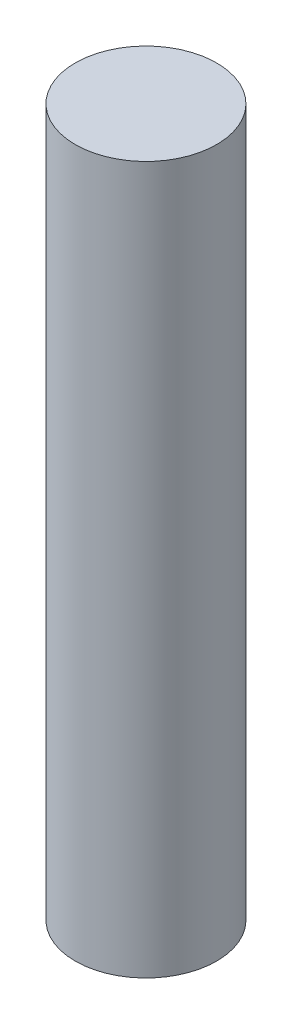
from build123d import *

# Parameters (mm, degrees)
SKETCH_1_R      = 1.5
EXTRUDE_1_DEPTH = 15


with BuildPart() as part:
    # 草图1 → 拉伸1 (new body)
    with BuildSketch(Plane(origin=(0, 0, 0), x_dir=(1, 0, 0), z_dir=(0, 1, 0))):
        with Locations(Location((0, 0, 0), (0, 0, 270))):
            Circle(SKETCH_1_R)
    extrude(amount=EXTRUDE_1_DEPTH)


solid = part.part
